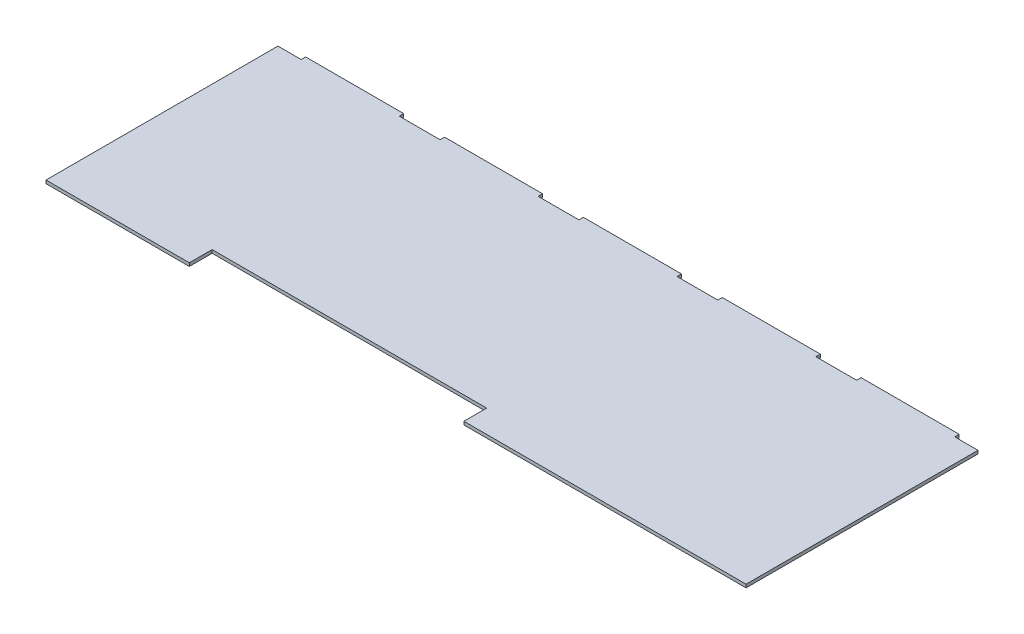
from build123d import *

# Parameters (mm, degrees)
SKETCH1_W           = 498.348
SKETCH1_H           = 165.1
BOSS_EXTRUDE1_DEPTH = 1.143
SKETCH2_W           = 69.85
SKETCH2_H           = 2.286
BOSS_EXTRUDE2_DEPTH = 3.175
LPATTERN1_COUNT     = 5
LPATTERN1_PITCH     = 98.8568
SKETCH3_W           = 96.5708
SKETCH3_H           = 16.239769195
SKETCH3_W_2         = 1.143
CUT_EXTRUDE1_DEPTH  = 264.517900145


with BuildPart() as part:
    # Sketch1 → Boss-Extrude1 (new, symmetric)
    with BuildSketch(Plane(origin=(0, 0, 0), x_dir=(1, 0, 0), z_dir=(0, 1, 0))):
        Rectangle(SKETCH1_W, SKETCH1_H)
    extrude(amount=BOSS_EXTRUDE1_DEPTH, both=True)

    # Sketch2 → Boss-Extrude2 (add)
    with BuildSketch(Plane(origin=(0, 0, -82.55), x_dir=(-1, 0, 0), z_dir=(0, 0, -1))):
        with Locations((-197.7136, 0)):
            Rectangle(SKETCH2_W, SKETCH2_H)
    boss_extrude2 = extrude(amount=BOSS_EXTRUDE2_DEPTH)

    # LPattern1: Boss-Extrude2 ×5
    with Locations(*[(-i * LPATTERN1_PITCH, 0, 0) for i in range(1, LPATTERN1_COUNT)]):
        add(boss_extrude2)

    # Sketch3 → Cut-Extrude1 (cut, through all)
    with BuildSketch(Plane.XZ.offset(1.143)):
        with Locations((-98.8568, 74.430115403)):
            Rectangle(SKETCH3_W, SKETCH3_H)
        with Locations((-48.8569, 74.430115403)):
            Rectangle(SKETCH3_W_2, SKETCH3_H)
        with Locations((-49.9999, 74.430115403)):
            Rectangle(SKETCH3_W_2, SKETCH3_H)
        with Locations((0, 74.430115403)):
            Rectangle(SKETCH3_W, SKETCH3_H)
    extrude(amount=-CUT_EXTRUDE1_DEPTH, mode=Mode.SUBTRACT)


solid = part.part
